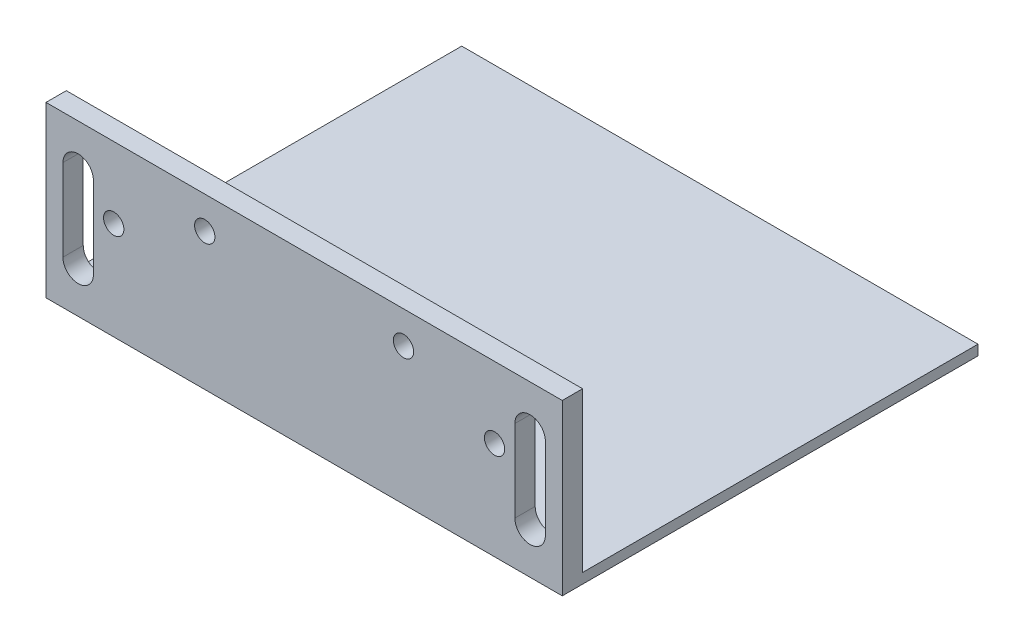
from build123d import *

# Parameters (mm, degrees)
SKETCH1_W           = 76.25
SKETCH1_H           = 58.4
BOSS_EXTRUDE1_DEPTH = 1.5
SKETCH2_W           = 76.25
SKETCH2_H           = 25
BOSS_EXTRUDE2_DEPTH = 3
SKETCH3_R           = 1.5
CUT_EXTRUDE1_DEPTH  = 77.475326904


with BuildPart() as part:
    # Sketch1 → Boss-Extrude1 (new body)
    with BuildSketch(Plane(origin=(0, 0, 0), x_dir=(1, 0, 0), z_dir=(0, 1, 0))):
        Rectangle(SKETCH1_W, SKETCH1_H)
    extrude(amount=BOSS_EXTRUDE1_DEPTH)

    # Sketch2 → Boss-Extrude2 (add)
    with BuildSketch(Plane.XY.offset(29.2)):
        with Locations((0, 12.5)):
            Rectangle(SKETCH2_W, SKETCH2_H)
    extrude(amount=BOSS_EXTRUDE2_DEPTH)

    # Sketch3 → Cut-Extrude1 (cut, through all)
    with BuildSketch(Plane.XY.offset(32.2)):
        with Locations((-28.125, 14.5)):
            Circle(SKETCH3_R)
        with Locations((-14.678089157, 20.247551858)):
            Circle(SKETCH3_R)
        with BuildLine():
            Line((-31.125, 18.55), (-31.125, 6.45))
            ThreePointArc((-31.125, 6.45), (-33.375, 4.2), (-35.625, 6.45))
            Line((-35.625, 6.45), (-35.625, 18.55))
            ThreePointArc((-35.625, 18.55), (-33.375, 20.8), (-31.125, 18.55))
        make_face()
    cut_extrude1 = extrude(amount=-CUT_EXTRUDE1_DEPTH, mode=Mode.SUBTRACT)

    # Mirror1: Cut-Extrude1 across plane
    add(cut_extrude1.mirror(Plane(origin=(0, 0, 0), x_dir=(0, 0, 1), z_dir=(1, 0, 0))), mode=Mode.SUBTRACT)


solid = part.part
